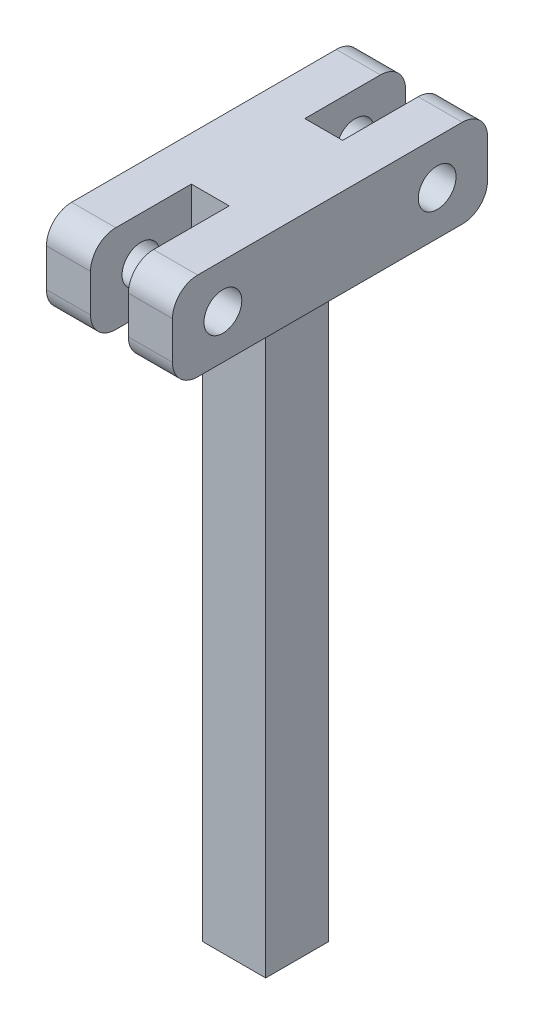
from build123d import *

# Parameters (mm, degrees)
CROQUIS1_W                 = 5
CROQUIS1_H                 = 5
SALIENTE_EXTRUIR1_DEPTH    = 50
CROQUIS2_R                 = 1.5
SALIENTE_EXTRUIR2_DEPTH    = 5
CORTAR_EXTRUIR1_DEPTH      = 56.167925464
CORTAR_EXTRUIR1_DEPTH_BACK = 56.167925464
CROQUIS3_W                 = 3
CROQUIS3_H                 = 8


with BuildPart() as part:
    # Croquis1 → Saliente-Extruir1 (new body)
    with BuildSketch(Plane(origin=(0, 0, 0), x_dir=(1, 0, 0), z_dir=(0, 1, 0))):
        with Locations((0, -0.104885861)):
            Rectangle(CROQUIS1_W, CROQUIS1_H)
    extrude(amount=-SALIENTE_EXTRUIR1_DEPTH)

    # Croquis2 → Saliente-Extruir2 (add, symmetric)
    with BuildSketch(Plane(origin=(0, 0, 0), x_dir=(0, 0, -1), z_dir=(1, 0, 0))):
        with BuildLine():
            Line((10.5, -3.5), (-10.5, -3.5))
            ThreePointArc((-10.5, -3.5), (-11.914213562, -2.914213562), (-12.5, -1.5))
            Line((-12.5, -1.5), (-12.5, 1.5))
            ThreePointArc((-12.5, 1.5), (-11.914213562, 2.914213562), (-10.5, 3.5))
            Line((-10.5, 3.5), (10.5, 3.5))
            ThreePointArc((10.5, 3.5), (11.914213562, 2.914213562), (12.5, 1.5))
            Line((12.5, 1.5), (12.5, -1.5))
            ThreePointArc((12.5, -1.5), (11.914213562, -2.914213562), (10.5, -3.5))
        make_face()
        with Locations((-8.5, 0)):
            Circle(CROQUIS2_R, mode=Mode.SUBTRACT)
        with Locations((8.5, 0)):
            Circle(CROQUIS2_R, mode=Mode.SUBTRACT)
    extrude(amount=SALIENTE_EXTRUIR2_DEPTH, both=True)

    # Croquis3 → Cortar-Extruir1 (cut, two sides: drawn at the far end of the back side and taken through both)
    with BuildSketch(Plane(origin=(0, 3.5, 0), x_dir=(1, 0, 0), z_dir=(0, 1, 0)).offset(-CORTAR_EXTRUIR1_DEPTH_BACK)):
        with Locations((0, 8.5)):
            Rectangle(CROQUIS3_W, CROQUIS3_H)
        with Locations((0, -8.5)):
            Rectangle(CROQUIS3_W, CROQUIS3_H)
    extrude(amount=CORTAR_EXTRUIR1_DEPTH + CORTAR_EXTRUIR1_DEPTH_BACK, mode=Mode.SUBTRACT)


solid = part.part
